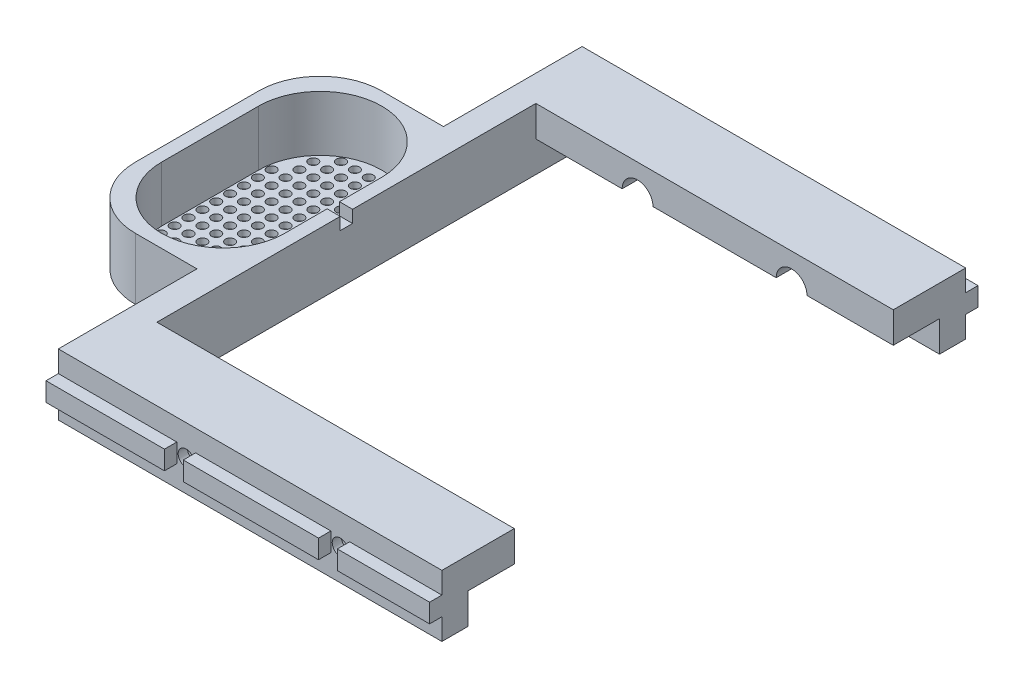
from build123d import *

# Parameters (mm, degrees)
EXTRUDE_1_DEPTH      = 20
CUT_EXTRUDE_2_DEPTH  = 18
SKETCH_5_R           = 1.5
CUT_EXTRUDE_3_DEPTH  = 18
SKETCH_6_W           = 124.5
SKETCH_6_H           = 6.1
EXTRUDE_2_DEPTH      = 4
EXTRUDE_3_DEPTH      = 4
SKETCH_8_R           = 2.6
CUT_EXTRUDE_4_DEPTH  = 12.5
CUT_EXTRUDE_START    = -10000
SKETCH_9_R           = 2.6
CUT_EXTRUDE_5_DEPTH  = 10000
SKETCH_10_W          = 6.1
SKETCH_10_H          = 6.1
SKETCH_10_R          = 2.6
CUT_EXTRUDE_6_DEPTH  = 4
CUT_EXTRUDE_START_2  = -4
SKETCH_11_W          = 6.1
SKETCH_11_H          = 6.1
SKETCH_11_R          = 2.6
CUT_EXTRUDE_7_DEPTH  = 4
SKETCH_12_R          = 5
CUT_EXTRUDE_8_DEPTH  = 5.5
CUT_EXTRUDE_START_3  = -5.5
SKETCH_14_R          = 5
CUT_EXTRUDE_9_DEPTH  = 5.5
SKETCH_15_W          = 116
SKETCH_15_H          = 15
EXTRUDE_4_DEPTH      = 10
SKETCH_16_W          = 4.25
SKETCH_16_H          = 4
CUT_EXTRUDE_10_DEPTH = 4
SKETCH_17_R          = 5
CUT_EXTRUDE_11_DEPTH = 155


with BuildPart() as part:
    # 草图1 → 凸台-拉伸1 (new body)
    with BuildSketch(Plane(origin=(0, 0, 0), x_dir=(1, 0, 0), z_dir=(0, 1, 0))):
        with BuildLine():
            Line((0, 85), (0, 76.5))
            Line((0, 76.5), (-116, 76.5))
            Line((-116, 76.5), (-116, 0))
            Line((-116, 0), (-116, -76.5))
            Line((-116, -76.5), (0, -76.5))
            Line((0, -76.5), (0, -85))
            Line((0, -85), (-124.5, -85))
            Line((-124.5, -85), (-124.5, -40))
            Line((-124.5, -40), (-144.5, -40))
            ThreePointArc((-144.5, -40), (-158.642135624, -34.142135624), (-164.5, -20))
            Line((-164.5, -20), (-164.5, 20))
            ThreePointArc((-164.5, 20), (-158.642135624, 34.142135624), (-144.5, 40))
            Line((-144.5, 40), (-124.5, 40))
            Line((-124.5, 40), (-124.5, 85))
            Line((-124.5, 85), (0, 85))
        make_face()
    extrude(amount=EXTRUDE_1_DEPTH)

    # 草图4 → 切除-拉伸2 (cut)
    with BuildSketch(Plane(origin=(0, 20, 0), x_dir=(1, 0, 0), z_dir=(0, 1, 0))):
        with BuildLine():
            Line((-160.25, 15.75), (-160.25, -15.75))
            ThreePointArc((-160.25, -15.75), (-140.25, -35.75), (-120.25, -15.75))
            Line((-120.25, -15.75), (-120.25, 15.75))
            ThreePointArc((-120.25, 15.75), (-140.25, 35.75), (-160.25, 15.75))
        make_face()
    extrude(amount=-CUT_EXTRUDE_2_DEPTH, mode=Mode.SUBTRACT)

    # 草图5 → 切除-拉伸3 (cut)
    with BuildSketch(Plane(origin=(0, 2, 0), x_dir=(1, 0, 0), z_dir=(0, 1, 0))):
        with Locations((-140.25, 0)):
            Circle(SKETCH_5_R)
        with Locations((-135.75, 0)):
            Circle(SKETCH_5_R)
        with Locations((-131.25, 0)):
            Circle(SKETCH_5_R)
        with Locations((-126.75, 0)):
            Circle(SKETCH_5_R)
        with Locations((-122.25, 0)):
            Circle(SKETCH_5_R)
        with Locations((-144.75, 0)):
            Circle(SKETCH_5_R)
        with Locations((-149.25, 0)):
            Circle(SKETCH_5_R)
        with Locations((-153.75, 0)):
            Circle(SKETCH_5_R)
        with Locations((-158.25, 0)):
            Circle(SKETCH_5_R)
        with Locations((-122.25, 4.5)):
            Circle(SKETCH_5_R)
        with Locations((-126.75, 4.5)):
            Circle(SKETCH_5_R)
        with Locations((-131.25, 4.5)):
            Circle(SKETCH_5_R)
        with Locations((-135.75, 4.5)):
            Circle(SKETCH_5_R)
        with Locations((-140.25, 4.5)):
            Circle(SKETCH_5_R)
        with Locations((-144.75, 4.5)):
            Circle(SKETCH_5_R)
        with Locations((-149.25, 4.5)):
            Circle(SKETCH_5_R)
        with Locations((-153.75, 4.5)):
            Circle(SKETCH_5_R)
        with Locations((-158.25, 4.5)):
            Circle(SKETCH_5_R)
        with Locations((-122.25, 9)):
            Circle(SKETCH_5_R)
        with Locations((-126.75, 9)):
            Circle(SKETCH_5_R)
        with Locations((-131.25, 9)):
            Circle(SKETCH_5_R)
        with Locations((-135.75, 9)):
            Circle(SKETCH_5_R)
        with Locations((-140.25, 9)):
            Circle(SKETCH_5_R)
        with Locations((-144.75, 9)):
            Circle(SKETCH_5_R)
        with Locations((-149.25, 9)):
            Circle(SKETCH_5_R)
        with Locations((-153.75, 9)):
            Circle(SKETCH_5_R)
        with Locations((-158.25, 9)):
            Circle(SKETCH_5_R)
        with Locations((-122.25, 13.5)):
            Circle(SKETCH_5_R)
        with Locations((-126.75, 13.5)):
            Circle(SKETCH_5_R)
        with Locations((-131.25, 13.5)):
            Circle(SKETCH_5_R)
        with Locations((-135.75, 13.5)):
            Circle(SKETCH_5_R)
        with Locations((-140.25, 13.5)):
            Circle(SKETCH_5_R)
        with Locations((-144.75, 13.5)):
            Circle(SKETCH_5_R)
        with Locations((-149.25, 13.5)):
            Circle(SKETCH_5_R)
        with Locations((-153.75, 13.5)):
            Circle(SKETCH_5_R)
        with Locations((-158.25, 13.5)):
            Circle(SKETCH_5_R)
        with Locations((-122.25, 18)):
            Circle(SKETCH_5_R)
        with Locations((-126.75, 18)):
            Circle(SKETCH_5_R)
        with Locations((-131.25, 18)):
            Circle(SKETCH_5_R)
        with Locations((-135.75, 18)):
            Circle(SKETCH_5_R)
        with Locations((-140.25, 18)):
            Circle(SKETCH_5_R)
        with Locations((-144.75, 18)):
            Circle(SKETCH_5_R)
        with Locations((-149.25, 18)):
            Circle(SKETCH_5_R)
        with Locations((-153.75, 18)):
            Circle(SKETCH_5_R)
        with Locations((-158.25, 18)):
            Circle(SKETCH_5_R)
        with Locations((-158.25, -4.5)):
            Circle(SKETCH_5_R)
        with Locations((-153.75, -4.5)):
            Circle(SKETCH_5_R)
        with Locations((-149.25, -4.5)):
            Circle(SKETCH_5_R)
        with Locations((-144.75, -4.5)):
            Circle(SKETCH_5_R)
        with Locations((-140.25, -4.5)):
            Circle(SKETCH_5_R)
        with Locations((-135.75, -4.5)):
            Circle(SKETCH_5_R)
        with Locations((-131.25, -4.5)):
            Circle(SKETCH_5_R)
        with Locations((-126.75, -4.5)):
            Circle(SKETCH_5_R)
        with Locations((-122.25, -4.5)):
            Circle(SKETCH_5_R)
        with Locations((-158.25, -9)):
            Circle(SKETCH_5_R)
        with Locations((-153.75, -9)):
            Circle(SKETCH_5_R)
        with Locations((-149.25, -9)):
            Circle(SKETCH_5_R)
        with Locations((-144.75, -9)):
            Circle(SKETCH_5_R)
        with Locations((-140.25, -9)):
            Circle(SKETCH_5_R)
        with Locations((-135.75, -9)):
            Circle(SKETCH_5_R)
        with Locations((-131.25, -9)):
            Circle(SKETCH_5_R)
        with Locations((-126.75, -9)):
            Circle(SKETCH_5_R)
        with Locations((-122.25, -9)):
            Circle(SKETCH_5_R)
        with Locations((-158.25, -13.5)):
            Circle(SKETCH_5_R)
        with Locations((-153.75, -13.5)):
            Circle(SKETCH_5_R)
        with Locations((-149.25, -13.5)):
            Circle(SKETCH_5_R)
        with Locations((-144.75, -13.5)):
            Circle(SKETCH_5_R)
        with Locations((-140.25, -13.5)):
            Circle(SKETCH_5_R)
        with Locations((-135.75, -13.5)):
            Circle(SKETCH_5_R)
        with Locations((-131.25, -13.5)):
            Circle(SKETCH_5_R)
        with Locations((-126.75, -13.5)):
            Circle(SKETCH_5_R)
        with Locations((-122.25, -13.5)):
            Circle(SKETCH_5_R)
        with Locations((-158.25, -18)):
            Circle(SKETCH_5_R)
        with Locations((-153.75, -18)):
            Circle(SKETCH_5_R)
        with Locations((-149.25, -18)):
            Circle(SKETCH_5_R)
        with Locations((-144.75, -18)):
            Circle(SKETCH_5_R)
        with Locations((-140.25, -18)):
            Circle(SKETCH_5_R)
        with Locations((-135.75, -18)):
            Circle(SKETCH_5_R)
        with Locations((-131.25, -18)):
            Circle(SKETCH_5_R)
        with Locations((-126.75, -18)):
            Circle(SKETCH_5_R)
        with Locations((-122.25, -18)):
            Circle(SKETCH_5_R)
        with Locations((-153.75, 22.5)):
            Circle(SKETCH_5_R)
        with Locations((-149.25, 22.5)):
            Circle(SKETCH_5_R)
        with Locations((-144.75, 22.5)):
            Circle(SKETCH_5_R)
        with Locations((-140.25, 22.5)):
            Circle(SKETCH_5_R)
        with Locations((-135.75, 22.5)):
            Circle(SKETCH_5_R)
        with Locations((-131.25, 22.5)):
            Circle(SKETCH_5_R)
        with Locations((-126.75, 22.5)):
            Circle(SKETCH_5_R)
        with Locations((-153.75, 27)):
            Circle(SKETCH_5_R)
        with Locations((-149.25, 27)):
            Circle(SKETCH_5_R)
        with Locations((-144.75, 27)):
            Circle(SKETCH_5_R)
        with Locations((-140.25, 27)):
            Circle(SKETCH_5_R)
        with Locations((-135.75, 27)):
            Circle(SKETCH_5_R)
        with Locations((-131.25, 27)):
            Circle(SKETCH_5_R)
        with Locations((-126.75, 27)):
            Circle(SKETCH_5_R)
        with Locations((-131.25, 31.5)):
            Circle(SKETCH_5_R)
        with Locations((-135.75, 31.5)):
            Circle(SKETCH_5_R)
        with Locations((-140.25, 31.5)):
            Circle(SKETCH_5_R)
        with Locations((-144.75, 31.5)):
            Circle(SKETCH_5_R)
        with Locations((-149.25, 31.5)):
            Circle(SKETCH_5_R)
        with Locations((-126.75, -22.5)):
            Circle(SKETCH_5_R)
        with Locations((-131.25, -22.5)):
            Circle(SKETCH_5_R)
        with Locations((-135.75, -22.5)):
            Circle(SKETCH_5_R)
        with Locations((-140.25, -22.5)):
            Circle(SKETCH_5_R)
        with Locations((-144.75, -22.5)):
            Circle(SKETCH_5_R)
        with Locations((-149.25, -22.5)):
            Circle(SKETCH_5_R)
        with Locations((-153.75, -22.5)):
            Circle(SKETCH_5_R)
        with Locations((-126.75, -27)):
            Circle(SKETCH_5_R)
        with Locations((-131.25, -27)):
            Circle(SKETCH_5_R)
        with Locations((-135.75, -27)):
            Circle(SKETCH_5_R)
        with Locations((-140.25, -27)):
            Circle(SKETCH_5_R)
        with Locations((-144.75, -27)):
            Circle(SKETCH_5_R)
        with Locations((-149.25, -27)):
            Circle(SKETCH_5_R)
        with Locations((-153.75, -27)):
            Circle(SKETCH_5_R)
        with Locations((-131.25, -31.5)):
            Circle(SKETCH_5_R)
        with Locations((-135.75, -31.5)):
            Circle(SKETCH_5_R)
        with Locations((-140.25, -31.5)):
            Circle(SKETCH_5_R)
        with Locations((-144.75, -31.5)):
            Circle(SKETCH_5_R)
        with Locations((-149.25, -31.5)):
            Circle(SKETCH_5_R)
    extrude(amount=-CUT_EXTRUDE_3_DEPTH, mode=Mode.SUBTRACT)

    # 草图6 → 凸台-拉伸2 (add)
    with BuildSketch(Plane(origin=(0, 0, -85), x_dir=(-1, 0, 0), z_dir=(0, 0, -1))):
        with Locations((62.25, 10)):
            Rectangle(SKETCH_6_W, SKETCH_6_H)
    extrude(amount=EXTRUDE_2_DEPTH)

    # 草图7 → 凸台-拉伸3 (add)
    with BuildSketch(Plane.XY.offset(85)):
        Polygon((-124.5, 13.05), (-124.5, 10), (-124.5, 6.95), (0, 6.95), (0, 10), (0, 13.05), align=None)
    extrude(amount=EXTRUDE_3_DEPTH)

    # 草图8 → 切除-拉伸4 (cut)
    with BuildSketch(Plane.XY.offset(-76.5)):
        with Locations((-33, 10)):
            Circle(SKETCH_8_R)
        with Locations((-83, 10)):
            Circle(SKETCH_8_R)
    extrude(amount=-CUT_EXTRUDE_4_DEPTH, mode=Mode.SUBTRACT)

    # 草图9 → 切除-拉伸5 (cut)
    with BuildSketch(Plane(origin=(0, 0, -89), x_dir=(-1, 0, 0), z_dir=(0, 0, -1)).offset(CUT_EXTRUDE_START)):
        with Locations((33, 10)):
            Circle(SKETCH_9_R)
        with Locations((83, 10)):
            Circle(SKETCH_9_R)
    extrude(amount=CUT_EXTRUDE_5_DEPTH, mode=Mode.SUBTRACT)

    # 草图10 → 切除-拉伸6 (cut)
    # profile 1 of 2: a face of its own
    with BuildSketch(Plane.XY.offset(89)):
        with Locations((-83, 10)):
            Rectangle(SKETCH_10_W, SKETCH_10_H)
        with Locations((-83, 10)):
            Circle(SKETCH_10_R, mode=Mode.SUBTRACT)
    # profile 2 of 2: a face of its own
    with BuildSketch(Plane.XY.offset(89)):
        with Locations((-33, 10)):
            Rectangle(SKETCH_10_W, SKETCH_10_H)
        with Locations((-33, 10)):
            Circle(SKETCH_10_R, mode=Mode.SUBTRACT)
    extrude(amount=-CUT_EXTRUDE_6_DEPTH, mode=Mode.SUBTRACT)

    # 草图11 → 切除-拉伸7 (cut)
    # profile 1 of 2: a face of its own
    with BuildSketch(Plane(origin=(0, 0, -89), x_dir=(-1, 0, 0), z_dir=(0, 0, -1)).offset(CUT_EXTRUDE_START_2)):
        with Locations((33, 10)):
            Rectangle(SKETCH_11_W, SKETCH_11_H)
        with Locations((33, 10)):
            Circle(SKETCH_11_R, mode=Mode.SUBTRACT)
    # profile 2 of 2: a face of its own
    with BuildSketch(Plane(origin=(0, 0, -89), x_dir=(-1, 0, 0), z_dir=(0, 0, -1)).offset(CUT_EXTRUDE_START_2)):
        with Locations((83, 10)):
            Rectangle(SKETCH_11_W, SKETCH_11_H)
        with Locations((83, 10)):
            Circle(SKETCH_11_R, mode=Mode.SUBTRACT)
    extrude(amount=CUT_EXTRUDE_7_DEPTH, mode=Mode.SUBTRACT)

    # 草图12 → 切除-拉伸8 (cut)
    with BuildSketch(Plane(origin=(0, 0, 76.5), x_dir=(-1, 0, 0), z_dir=(0, 0, -1))):
        with Locations((33, 10)):
            Circle(SKETCH_12_R)
        with Locations((83, 10)):
            Circle(SKETCH_12_R)
    extrude(amount=-CUT_EXTRUDE_8_DEPTH, mode=Mode.SUBTRACT)

    # 草图14 → 切除-拉伸9 (cut)
    with BuildSketch(Plane.XY.offset(-76.5).offset(CUT_EXTRUDE_START_3)):
        with Locations((-83, 10)):
            Circle(SKETCH_14_R)
        with Locations((-33, 10)):
            Circle(SKETCH_14_R)
    extrude(amount=CUT_EXTRUDE_9_DEPTH, mode=Mode.SUBTRACT)

    # 草图15 → 凸台-拉伸4 (add)
    with BuildSketch(Plane(origin=(0, 20, 0), x_dir=(1, 0, 0), z_dir=(0, 1, 0))):
        with Locations((-58, 69)):
            Rectangle(SKETCH_15_W, SKETCH_15_H)
        with Locations((-58, -69)):
            Rectangle(SKETCH_15_W, SKETCH_15_H)
    extrude(amount=-EXTRUDE_4_DEPTH)

    # 草图16 → 切除-拉伸10 (cut)
    with BuildSketch(Plane(origin=(0, 20, 0), x_dir=(1, 0, 0), z_dir=(0, 1, 0))):
        with Locations((-118.125, 0)):
            Rectangle(SKETCH_16_W, SKETCH_16_H)
    extrude(amount=-CUT_EXTRUDE_10_DEPTH, mode=Mode.SUBTRACT)

    # 草图17 → 切除-拉伸11 (cut)
    with BuildSketch(Plane.XY.offset(-76.5)):
        with Locations((-83, 10)):
            Circle(SKETCH_17_R)
        with Locations((-33, 10)):
            Circle(SKETCH_17_R)
    extrude(amount=CUT_EXTRUDE_11_DEPTH, mode=Mode.SUBTRACT)


solid = part.part
